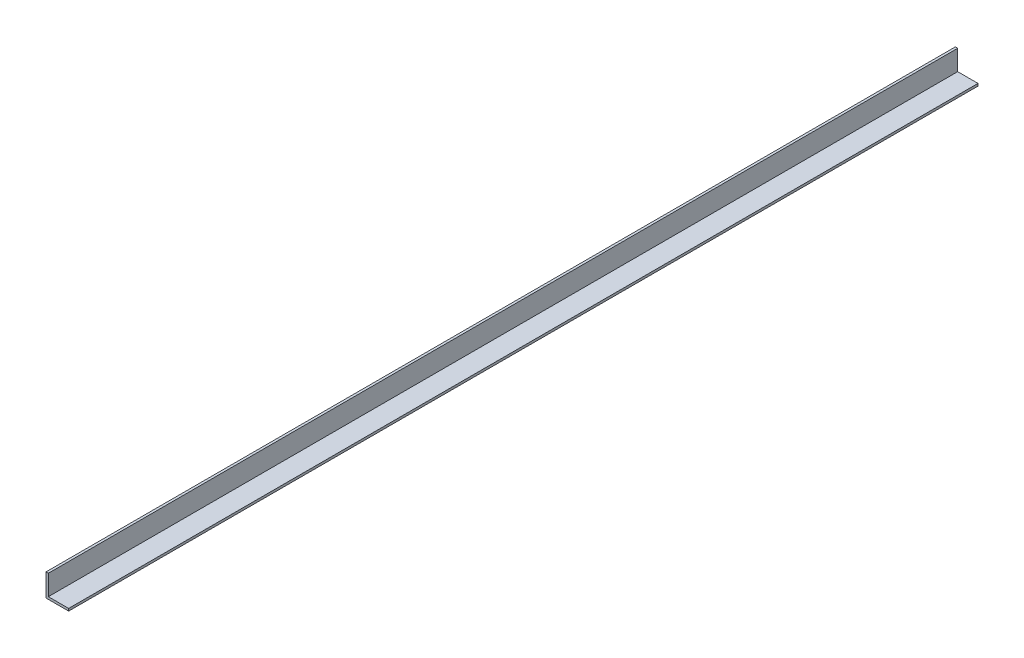
from build123d import *

# Parameters (mm, degrees)
SALIENTE_EXTRUIR1_DEPTH = 6100


with BuildPart() as part:
    # Croquis1 → Saliente-Extruir1 (new body)
    with BuildSketch(Plane.XY):
        Polygon((0, 152), (0, 0), (152, 0), (152, 15.88), (15.88, 15.88), (15.88, 152), align=None)
    extrude(amount=-SALIENTE_EXTRUIR1_DEPTH)


solid = part.part
